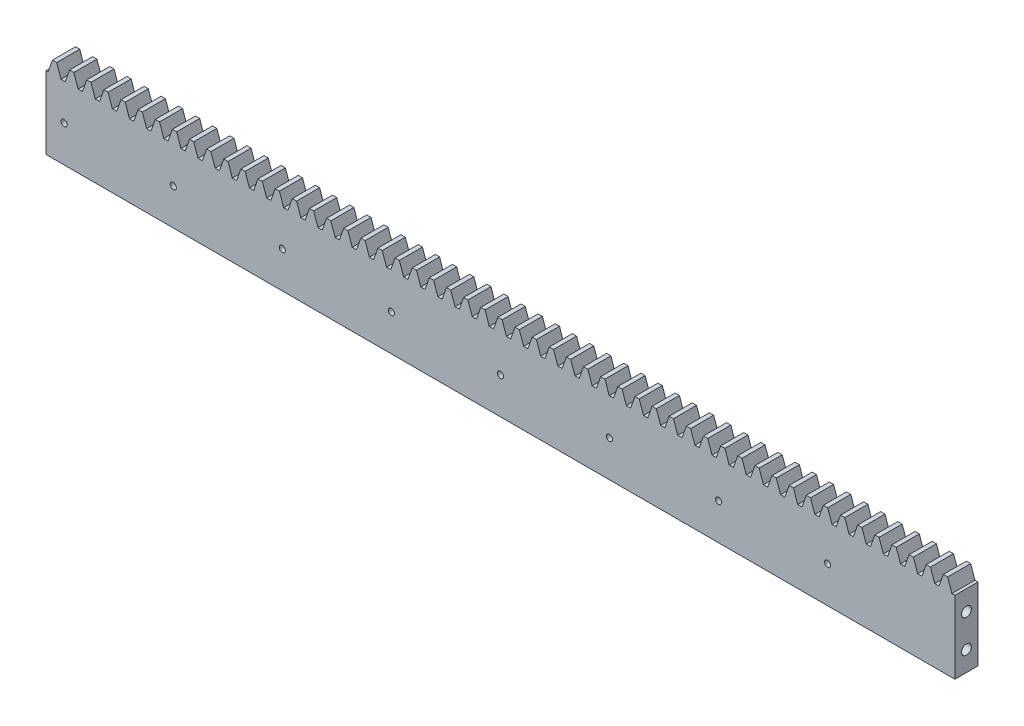
from build123d import *

# Parameters (mm, degrees)
SKETCH6_R           = 0.85
BOSS_EXTRUDE2_DEPTH = 6.35
SKETCH9_R           = 1.35
CUT_EXTRUDE2_DEPTH  = 20


with BuildPart() as part:
    # Sketch6 → Boss-Extrude2 (new body)
    with BuildSketch(Plane.XY):
        Polygon((250, -3.375), (250, 16.625), (249.167655, 16.625), (247.988655, 20), (246.81177, 20), (245.63277, 16.625), (244.45527, 16.625), (243.27627, 20), (242.099385, 20), (240.920385, 16.625), (239.742885, 16.625), (238.563885, 20), (237.387, 20), (236.208, 16.625), (235.0305, 16.625), (233.8515, 20), (232.674615, 20), (231.495615, 16.625), (230.318115, 16.625), (229.139115, 20), (227.96223, 20), (226.78323, 16.625), (225.60573, 16.625), (224.42673, 20), (223.249845, 20), (222.070845, 16.625), (220.893345, 16.625), (219.714345, 20), (218.53746, 20), (217.35846, 16.625), (216.18096, 16.625), (215.00196, 20), (213.825075, 20), (212.646075, 16.625), (211.468575, 16.625), (210.289575, 20), (209.11269, 20), (207.93369, 16.625), (206.75619, 16.625), (205.57719, 20), (204.400305, 20), (203.221305, 16.625), (202.043805, 16.625), (200.864805, 20), (199.68792, 20), (198.50892, 16.625), (197.33142, 16.625), (196.15242, 20), (194.975535, 20), (193.796535, 16.625), (192.619035, 16.625), (191.440035, 20), (190.26315, 20), (189.08415, 16.625), (187.90665, 16.625), (186.72765, 20), (185.550765, 20), (184.371765, 16.625), (183.194265, 16.625), (182.015265, 20), (180.83838, 20), (179.65938, 16.625), (178.48188, 16.625), (177.30288, 20), (176.125995, 20), (174.946995, 16.625), (173.769495, 16.625), (172.590495, 20), (171.41361, 20), (170.23461, 16.625), (169.05711, 16.625), (167.87811, 20), (166.701225, 20), (165.522225, 16.625), (164.344725, 16.625), (163.165725, 20), (161.98884, 20), (160.80984, 16.625), (159.63234, 16.625), (158.45334, 20), (157.276455, 20), (156.097455, 16.625), (154.919955, 16.625), (153.740955, 20), (152.56407, 20), (151.38507, 16.625), (150.20757, 16.625), (149.02857, 20), (147.851685, 20), (146.672685, 16.625), (145.495185, 16.625), (144.316185, 20), (143.1393, 20), (141.9603, 16.625), (140.7828, 16.625), (139.6038, 20), (138.426915, 20), (137.247915, 16.625), (136.070415, 16.625), (134.891415, 20), (133.71453, 20), (132.53553, 16.625), (131.35803, 16.625), (130.17903, 20), (129.002145, 20), (127.823145, 16.625), (126.645645, 16.625), (125.466645, 20), (124.28976, 20), (123.11076, 16.625), (121.93326, 16.625), (120.75426, 20), (119.577375, 20), (118.398375, 16.625), (117.220875, 16.625), (116.041875, 20), (114.86499, 20), (113.68599, 16.625), (112.50849, 16.625), (111.32949, 20), (110.152605, 20), (108.973605, 16.625), (107.796105, 16.625), (106.617105, 20), (105.44022, 20), (104.26122, 16.625), (103.08372, 16.625), (101.90472, 20), (100.727835, 20), (99.548835, 16.625), (98.371335, 16.625), (97.192335, 20), (96.01545, 20), (94.83645, 16.625), (93.65895, 16.625), (92.47995, 20), (91.303065, 20), (90.124065, 16.625), (88.946565, 16.625), (87.767565, 20), (86.59068, 20), (85.41168, 16.625), (84.23418, 16.625), (83.05518, 20), (81.878295, 20), (80.699295, 16.625), (79.521795, 16.625), (78.342795, 20), (77.16591, 20), (75.98691, 16.625), (74.80941, 16.625), (73.63041, 20), (72.453525, 20), (71.274525, 16.625), (70.097025, 16.625), (68.918025, 20), (67.74114, 20), (66.56214, 16.625), (65.38464, 16.625), (64.20564, 20), (63.028755, 20), (61.849755, 16.625), (60.672255, 16.625), (59.493255, 20), (58.31637, 20), (57.13737, 16.625), (55.95987, 16.625), (54.78087, 20), (53.603985, 20), (52.424985, 16.625), (51.247485, 16.625), (50.068485, 20), (48.8916, 20), (47.7126, 16.625), (46.5351, 16.625), (45.3561, 20), (44.179215, 20), (43.000215, 16.625), (41.822715, 16.625), (40.643715, 20), (39.46683, 20), (38.28783, 16.625), (37.11033, 16.625), (35.93133, 20), (34.754445, 20), (33.575445, 16.625), (32.397945, 16.625), (31.218945, 20), (30.04206, 20), (28.86306, 16.625), (27.68556, 16.625), (26.50656, 20), (25.329675, 20), (24.150675, 16.625), (22.973175, 16.625), (21.794175, 20), (20.61729, 20), (19.43829, 16.625), (18.26079, 16.625), (17.08179, 20), (15.904905, 20), (14.725905, 16.625), (13.548405, 16.625), (12.369405, 20), (11.19252, 20), (10.01352, 16.625), (8.83602, 16.625), (7.65702, 20), (6.480135, 20), (5.301135, 16.625), (4.123635, 16.625), (2.944635, 20), (1.76775, 20), (0.58875, 16.625), (0, 16.625), (0, -3.375), align=None)
        with Locations((5, 6.625)):
            Circle(SKETCH6_R, mode=Mode.SUBTRACT)
        with Locations((35, 6.625)):
            Circle(SKETCH6_R, mode=Mode.SUBTRACT)
        with Locations((65, 6.625)):
            Circle(SKETCH6_R, mode=Mode.SUBTRACT)
        with Locations((95, 6.625)):
            Circle(SKETCH6_R, mode=Mode.SUBTRACT)
        with Locations((125, 6.625)):
            Circle(SKETCH6_R, mode=Mode.SUBTRACT)
        with Locations((155, 6.625)):
            Circle(SKETCH6_R, mode=Mode.SUBTRACT)
        with Locations((185, 6.625)):
            Circle(SKETCH6_R, mode=Mode.SUBTRACT)
        with Locations((215, 6.625)):
            Circle(SKETCH6_R, mode=Mode.SUBTRACT)
    extrude(amount=BOSS_EXTRUDE2_DEPTH)

    # Sketch9 → Cut-Extrude2 (cut)
    with BuildSketch(Plane(origin=(250, 0, 0), x_dir=(0, 0, -1), z_dir=(1, 0, 0))):
        with Locations((-3.175, 2.125)):
            Circle(SKETCH9_R)
        with Locations((-3.175, 11.125)):
            Circle(SKETCH9_R)
    extrude(amount=-CUT_EXTRUDE2_DEPTH, mode=Mode.SUBTRACT)


solid = part.part
